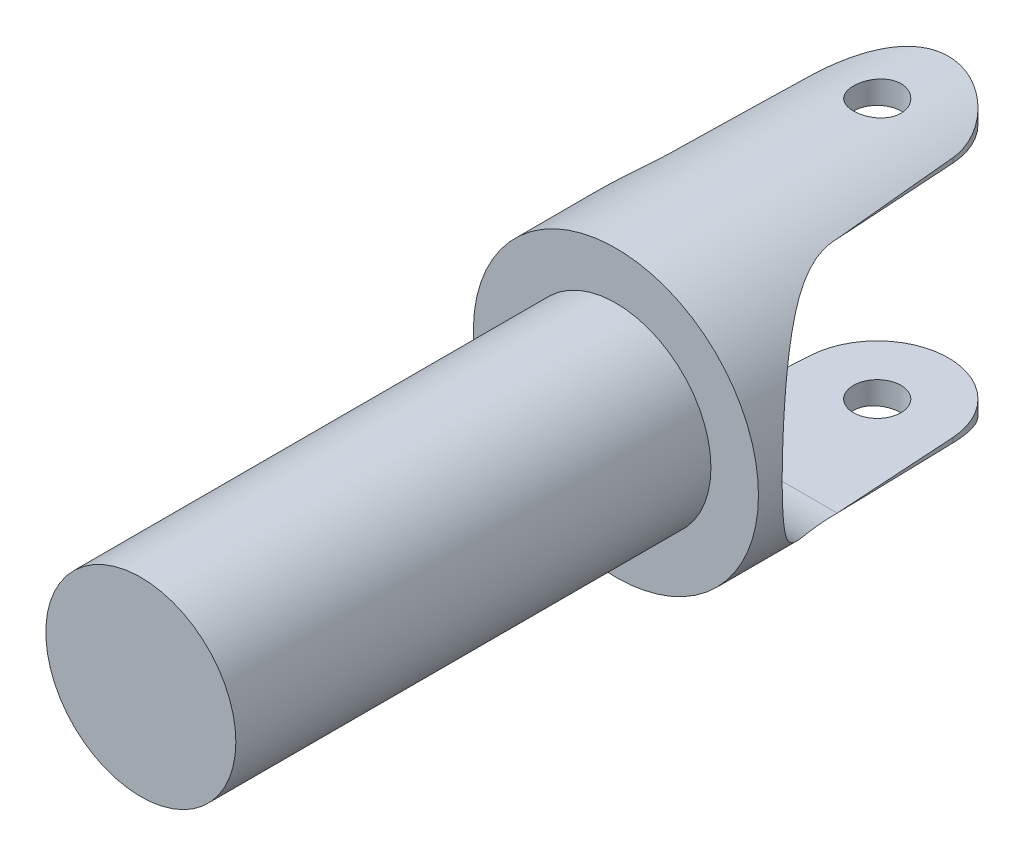
from build123d import *
from build123d.topology import SkipClean

# Parameters (mm, degrees)
BASE_SKETCH_R                   = 30
BASE_EXTRUDE_DEPTH              = 30
PIN_SKETCH_R                    = 20
PIN_EXTRUDE_DEPTH               = 100
SIDE_CUT_REACH                  = 138.748
SIDE_CUT_END_RADIUS             = 30
SIDE_CUT_SKETCH_R               = 25
SIDE_CUT_DIRECTION_2_REACH      = 138.748
SIDE_CUT_DIRECTION_2_END_RADIUS = 30
WING_EXTRUDE_REACH              = 146.309
WING_EXTRUDE_END_RADIUS         = 30
PIN_HOLE_CUT_DEPTH              = 145.308696956
PIN_HOLE_CUT_DEPTH_BACK         = 145.308696956
PIN_HOLE_SKETCH_R               = 5


with BuildPart() as part:
    # Base Sketch → Base Extrude (new body)
    with BuildSketch(Plane.XY):
        Circle(BASE_SKETCH_R)
    extrude(amount=BASE_EXTRUDE_DEPTH)

    # Pin Sketch → Pin Extrude (add)
    with BuildSketch(Plane.XY.offset(30)):
        Circle(PIN_SKETCH_R)
    extrude(amount=PIN_EXTRUDE_DEPTH)

    # Side Cut: up to this cylinder (the profile starts inside it)
    side_cut_end = Plane(origin=(0, 0, 0), z_dir=(0, 0, -1)) * Cylinder(SIDE_CUT_END_RADIUS, 338.496, mode=Mode.PRIVATE)
    # Side Cut Sketch → Side Cut (cut, up to the surface)
    with BuildSketch(Plane(origin=(0, 0, 0), x_dir=(0, 0, -1), z_dir=(1, 0, 0)), mode=Mode.PRIVATE) as side_cut_sk1:
        Circle(SIDE_CUT_SKETCH_R)
    side_cut_tool1 = extrude(side_cut_sk1.sketch, amount=-SIDE_CUT_REACH, mode=Mode.PRIVATE) & side_cut_end
    add(side_cut_tool1.solids().sort_by_distance((0, 0, 0))[0], mode=Mode.SUBTRACT)

    # Side Cut direction 2: up to this cylinder (the profile starts inside it)
    side_cut_direction_2_end = Plane(origin=(0, 0, 0), z_dir=(0, 0, -1)) * Cylinder(SIDE_CUT_DIRECTION_2_END_RADIUS, 338.496, mode=Mode.PRIVATE)
    # Side Cut Sketch → Side Cut direction 2 (cut, up to the surface)
    with BuildSketch(Plane(origin=(0, 0, 0), x_dir=(0, 0, -1), z_dir=(1, 0, 0)), mode=Mode.PRIVATE) as side_cut_direction_2_sk1:
        Circle(SIDE_CUT_SKETCH_R)
    side_cut_direction_2_tool1 = extrude(side_cut_direction_2_sk1.sketch, amount=SIDE_CUT_DIRECTION_2_REACH, mode=Mode.PRIVATE) & side_cut_direction_2_end
    add(side_cut_direction_2_tool1.solids().sort_by_distance((0, 0, 0))[0], mode=Mode.SUBTRACT)

    # Wing Extrude: up to this cylinder (the profile starts inside it)
    with SkipClean():  # the faces are left unmerged after this step: merging them gives an invalid solid
        wing_extrude_end = Plane(origin=(0, 0, -18.188486), z_dir=(0, 0, -1)) * Cylinder(WING_EXTRUDE_END_RADIUS, 353.618, mode=Mode.PRIVATE)
        # Wing Sketch → Wing Extrude (add, up to the surface)
        with BuildSketch(Plane(origin=(0, 25, 0), x_dir=(1, 0, 0), z_dir=(0, 1, 0)), mode=Mode.PRIVATE) as wing_extrude_sk1:
            with BuildLine():
                Line((-16.583123952, 0), (-14.971098535, 25.930703308))
                ThreePointArc((-14.971098535, 25.930703308), (0, 40), (14.971098535, 25.930703308))
                Line((14.971098535, 25.930703308), (16.583123952, 0))
                Line((16.583123952, 0), (-16.583123952, 0))
            make_face()
        wing_extrude_tool1 = extrude(wing_extrude_sk1.sketch, amount=WING_EXTRUDE_REACH, mode=Mode.PRIVATE) & wing_extrude_end
        wing_extrude = wing_extrude_tool1.solids().sort_by_distance((0, 25, -18.188486))[0]
        add(wing_extrude)

    # Wing Mirror: Wing Extrude across plane
    with SkipClean():  # the faces are left unmerged after this step: merging them gives an invalid solid
        add(wing_extrude.mirror(Plane.ZX))

    # Pin Hole Sketch → Pin Hole Cut (cut, two sides: drawn at the far end of the back side and taken through both)
    with SkipClean():  # the faces are left unmerged after this step: merging them gives an invalid solid
        with BuildSketch(Plane.XZ.offset(-25).offset(-PIN_HOLE_CUT_DEPTH_BACK)):
            with Locations(Location((0, -25, 0), (0, 0, 90))):
                Circle(PIN_HOLE_SKETCH_R)
        extrude(amount=PIN_HOLE_CUT_DEPTH + PIN_HOLE_CUT_DEPTH_BACK, mode=Mode.SUBTRACT)


solid = part.part
